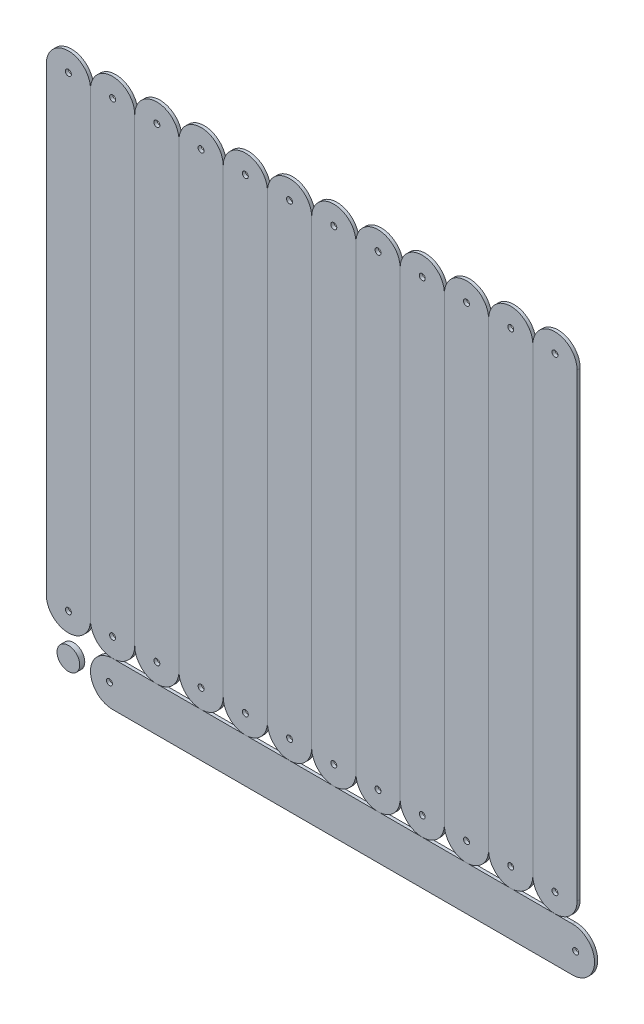
from build123d import *

# Parameters (mm, degrees)
SKETCH1_R           = 1.5
SKETCH1_W           = 11.1125
SKETCH1_H           = 231.03714
BOSS_EXTRUDE1_DEPTH = 1.5875
LPATTERN1_COUNT     = 12
LPATTERN1_PITCH     = 22.225
SKETCH3_R           = 5.697657203
BOSS_EXTRUDE2_DEPTH = 2.54
CIRPATTERN1_COUNT   = 2
CIRPATTERN1_ANGLE   = 90


with BuildPart() as part:
    # Sketch1 → Boss-Extrude1 (new body)
    # profile 1 of 4: a face of its own
    with BuildSketch(Plane.XY):
        with BuildLine():
            ThreePointArc((-11.1125, 115.51857), (0, 126.63107), (11.1125, 115.51857))
            Line((11.1125, 115.51857), (-11.1125, 115.51857))
        make_face()
        with Locations((0, 117.10607)):
            Circle(SKETCH1_R, mode=Mode.SUBTRACT)
    # profile 2 of 4: a face of its own
    with BuildSketch(Plane.XY):
        with Locations((5.55625, 0)):
            Rectangle(SKETCH1_W, SKETCH1_H)
    # profile 3 of 4: a face of its own
    with BuildSketch(Plane.XY):
        with Locations((-5.55625, 0)):
            Rectangle(SKETCH1_W, SKETCH1_H)
    # profile 4 of 4: a face of its own
    with BuildSketch(Plane.XY):
        with BuildLine():
            Line((-11.1125, -115.51857), (11.1125, -115.51857))
            ThreePointArc((11.1125, -115.51857), (0, -126.63107), (-11.1125, -115.51857))
        make_face()
        with Locations((0, -117.10607)):
            Circle(SKETCH1_R, mode=Mode.SUBTRACT)
    extrude(amount=BOSS_EXTRUDE1_DEPTH)


with BuildPart() as lpattern1_1:
    # LPattern1: pattern copy
    add(part.part.moved(Location(Vector(1, 0, 0) * (1 * LPATTERN1_PITCH))))


with BuildPart() as lpattern1_2:
    # LPattern1: pattern copy
    add(part.part.moved(Location(Vector(1, 0, 0) * (2 * LPATTERN1_PITCH))))


with BuildPart() as lpattern1_3:
    # LPattern1: pattern copy
    add(part.part.moved(Location(Vector(1, 0, 0) * (3 * LPATTERN1_PITCH))))


with BuildPart() as lpattern1_4:
    # LPattern1: pattern copy
    add(part.part.moved(Location(Vector(1, 0, 0) * (4 * LPATTERN1_PITCH))))


with BuildPart() as lpattern1_5:
    # LPattern1: pattern copy
    add(part.part.moved(Location(Vector(1, 0, 0) * (5 * LPATTERN1_PITCH))))


with BuildPart() as lpattern1_6:
    # LPattern1: pattern copy
    add(part.part.moved(Location(Vector(1, 0, 0) * (6 * LPATTERN1_PITCH))))


with BuildPart() as lpattern1_7:
    # LPattern1: pattern copy
    add(part.part.moved(Location(Vector(1, 0, 0) * (7 * LPATTERN1_PITCH))))


with BuildPart() as lpattern1_8:
    # LPattern1: pattern copy
    add(part.part.moved(Location(Vector(1, 0, 0) * (8 * LPATTERN1_PITCH))))


with BuildPart() as lpattern1_9:
    # LPattern1: pattern copy
    add(part.part.moved(Location(Vector(1, 0, 0) * (9 * LPATTERN1_PITCH))))


with BuildPart() as lpattern1_10:
    # LPattern1: pattern copy
    add(part.part.moved(Location(Vector(1, 0, 0) * (10 * LPATTERN1_PITCH))))


with BuildPart() as lpattern1_11:
    # LPattern1: pattern copy
    add(part.part.moved(Location(Vector(1, 0, 0) * (11 * LPATTERN1_PITCH))))


with BuildPart() as body_13:
    # Sketch3 → Boss-Extrude2 (new body)
    with BuildSketch(Plane.XY.offset(1.5875)):
        with Locations((0, -137.74357)):
            Circle(SKETCH3_R)
    extrude(amount=-BOSS_EXTRUDE2_DEPTH)


with BuildPart() as cirpattern1_1:
    # CirPattern1: pattern copy
    add(part.part.rotate(Axis((0, -137.74357, 0), (0, 0, -1)), 1 * CIRPATTERN1_ANGLE / (CIRPATTERN1_COUNT - 1)))


solid = Compound([part.part, lpattern1_1.part, lpattern1_2.part, lpattern1_3.part, lpattern1_4.part, lpattern1_5.part, lpattern1_6.part, lpattern1_7.part, lpattern1_8.part, lpattern1_9.part, lpattern1_10.part, lpattern1_11.part, body_13.part, cirpattern1_1.part])
